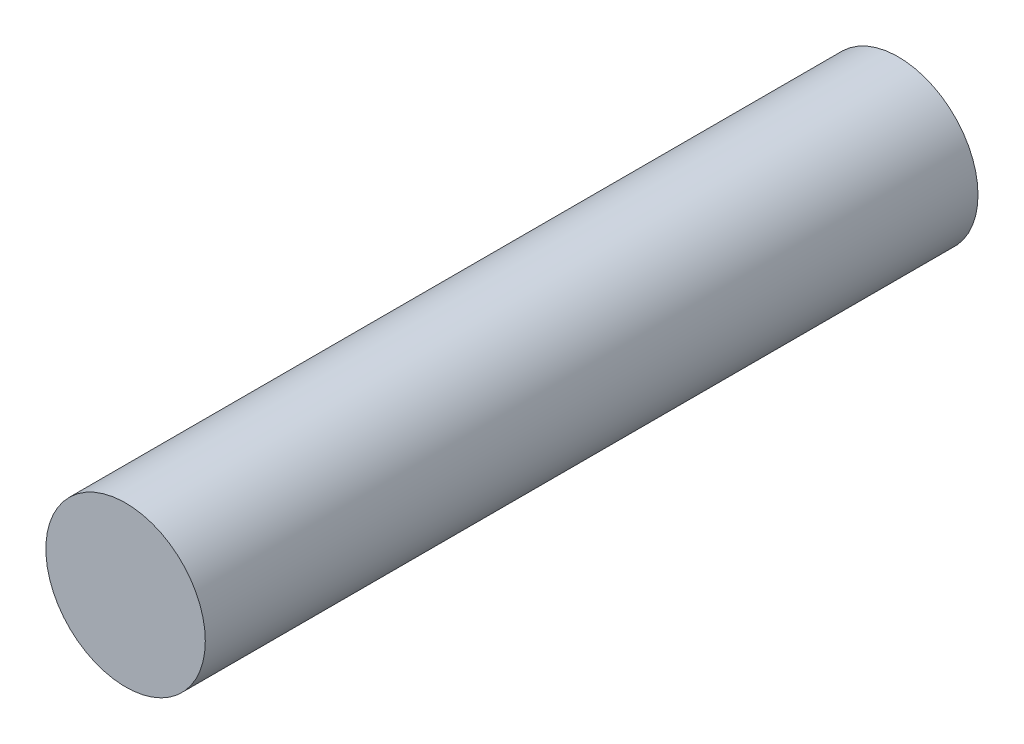
from build123d import *

# Parameters (mm, degrees)
SKETCH1_R           = 1.651
BOSS_EXTRUDE1_DEPTH = 16


with BuildPart() as part:
    # Sketch1 → Boss-Extrude1 (new body)
    with BuildSketch(Plane.XY):
        Circle(SKETCH1_R)
    extrude(amount=BOSS_EXTRUDE1_DEPTH)


solid = part.part
